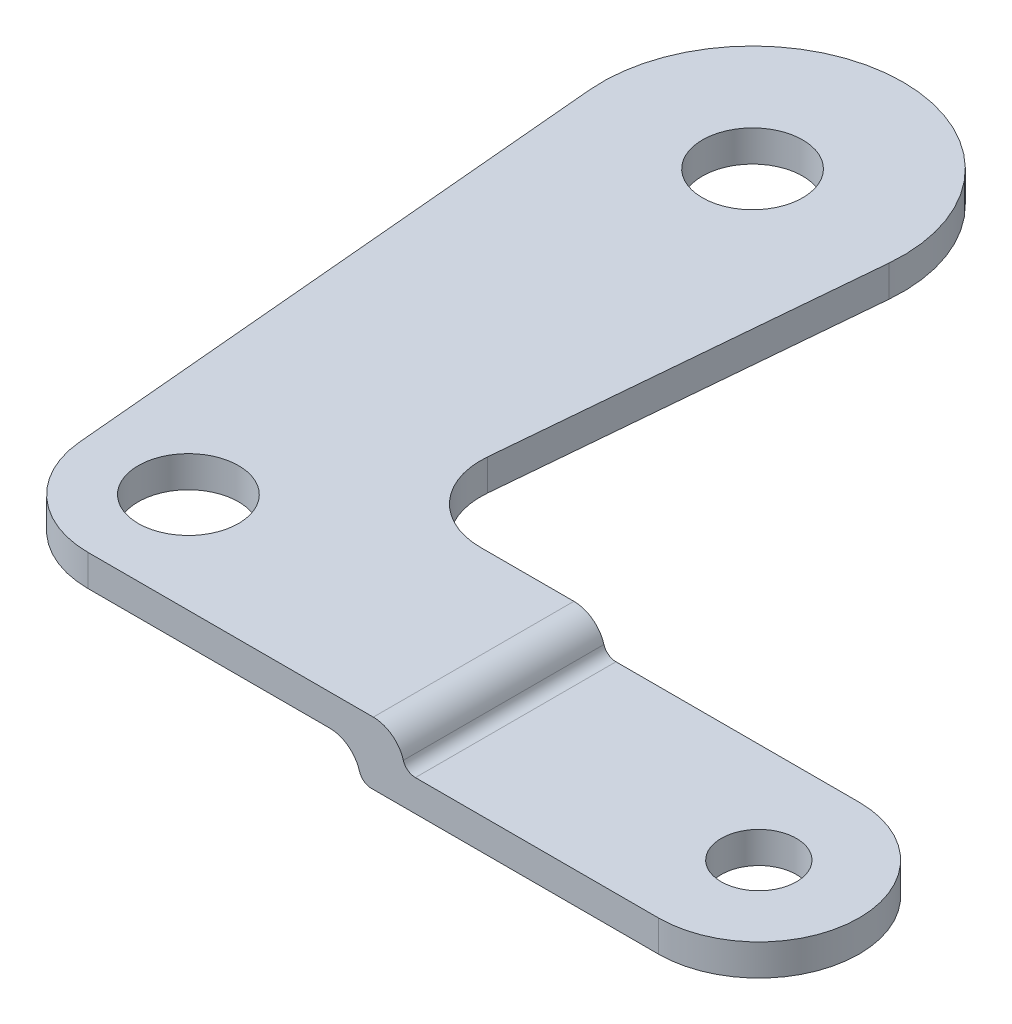
from build123d import *

# Parameters (mm, degrees)
SKETCH1_R           = 3
BOSS_EXTRUDE1_DEPTH = 2.5
BOSS_EXTRUDE2_START = 2.5
SKETCH1_3_R         = 4
BOSS_EXTRUDE2_DEPTH = 2.5
BOSS_EXTRUDE3_DEPTH = 16


with BuildPart() as part:
    # Sketch1 → Boss-Extrude1 (new body)
    with BuildSketch(Plane(origin=(0, 0, 0), x_dir=(1, 0, 0), z_dir=(0, 1, 0))):
        with BuildLine():
            Line((22.75, -8), (45.5, -8))
            ThreePointArc((45.5, -8), (53.5, 0), (45.5, 8))
            Line((45.5, 8), (22.75, 8))
            Line((22.75, 8), (22.75, -8))
        make_face()
        with Locations(Location((45.5, 0, 0), (0, 0, 270))):
            Circle(SKETCH1_R, mode=Mode.SUBTRACT)
    extrude(amount=BOSS_EXTRUDE1_DEPTH)



with BuildPart() as body_2:
    # Sketch1<3> → Boss-Extrude2 (new body)
    with BuildSketch(Plane(origin=(0, 0, 0), x_dir=(1, 0, 0), z_dir=(0, 1, 0)).offset(BOSS_EXTRUDE2_START)):
        with BuildLine():
            Line((0, -8), (22.75, -8))
            Line((22.75, -8), (22.75, 8))
            Line((22.75, 8), (15.305028665, 8))
            ThreePointArc((15.305028665, 8), (10.877839941, 9.950308654), (9.328779377, 14.533333333))
            Line((9.328779377, 14.533333333), (11.952427887, 43.93254122))
            Line((11.952427887, 43.93254122), (11.952498577, 43.933333333))
            ThreePointArc((11.952498577, 43.933333333), (0, 57), (-11.952498577, 43.933333333))
            Line((-11.952498577, 43.933333333), (-7.968332384, -0.711111111))
            ThreePointArc((-7.968332384, -0.711111111), (-5.399588462, -5.902918299), (0, -8))
        make_face()
        with Locations(Location((0, 0, 0), (0, 0, 270))):
            Circle(SKETCH1_3_R, mode=Mode.SUBTRACT)
        with Locations(Location((0, 45, 0), (0, 0, 270))):
            Circle(SKETCH1_3_R, mode=Mode.SUBTRACT)
    extrude(amount=BOSS_EXTRUDE2_DEPTH)


with BuildPart() as part_1:
    add(part.part)

    add(body_2.part)  # Boss-Extrude3 merges body 2
    # Sketch2 → Boss-Extrude3 (add)
    with BuildSketch(Plane.XY.offset(8)):
        with BuildLine():
            Line((22.75, 5), (19.25, 5))
            Line((19.25, 5), (19.25, 2.5))
            ThreePointArc((19.25, 2.5), (20.744035762, 2.004459314), (21.645787119, 0.714285714))
            ThreePointArc((21.645787119, 0.714285714), (22.006487662, 0.198216274), (22.604101966, 0))
            Line((22.604101966, 0), (22.75, 0))
            Line((22.75, 0), (22.75, 2.5))
            Line((22.75, 2.5), (26.104101966, 2.5))
            ThreePointArc((26.104101966, 2.5), (25.506487662, 2.698216274), (25.145787119, 3.214285714))
            ThreePointArc((25.145787119, 3.214285714), (24.244035762, 4.504459314), (22.75, 5))
        make_face()
    extrude(amount=-BOSS_EXTRUDE3_DEPTH)


solid = part_1.part
